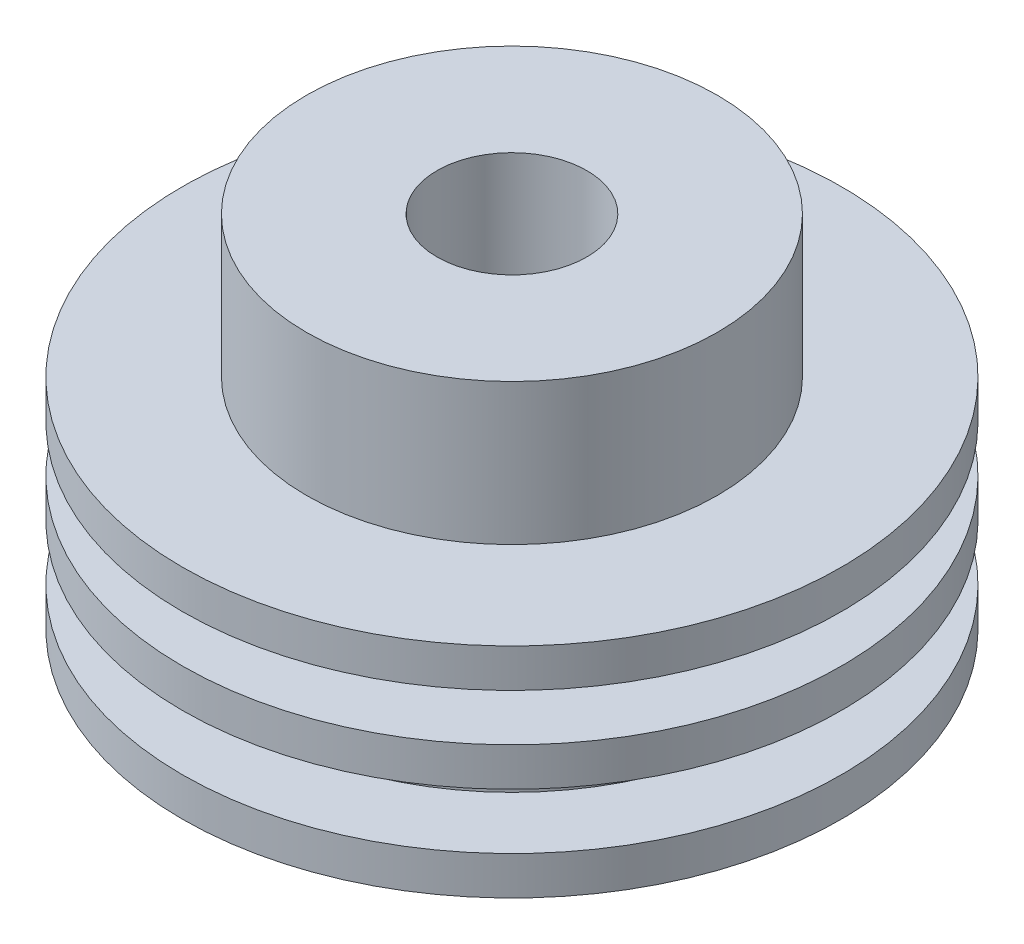
from build123d import *


with BuildPart() as part:
    # 草图1 → 旋转1 (revolve)
    with BuildSketch(Plane.XY, mode=Mode.PRIVATE) as revolve_1_sk:
        Polygon((6.347582984, 61.752914463), (17.410513329, 61.752914463), (17.410513329, 49.783186549), (27.929365131, 49.783186549), (27.929365131, 46.5187153), (21.581782147, 46.5187153), (21.581782147, 42.528805996), (27.929365131, 42.528805996), (27.929365131, 39.264334746), (21.581782147, 39.264334746), (21.581782147, 34.548987387), (27.929365131, 34.548987387), (27.929365131, 31.284516138), (6.347582984, 31.284516138), align=None)
    revolve(revolve_1_sk.sketch.rotate(Axis((0, 82.971977582, 0), (0, -1, 0)), 90), axis=Axis((0, 82.971977582, 0), (0, -1, 0)))


solid = part.part
